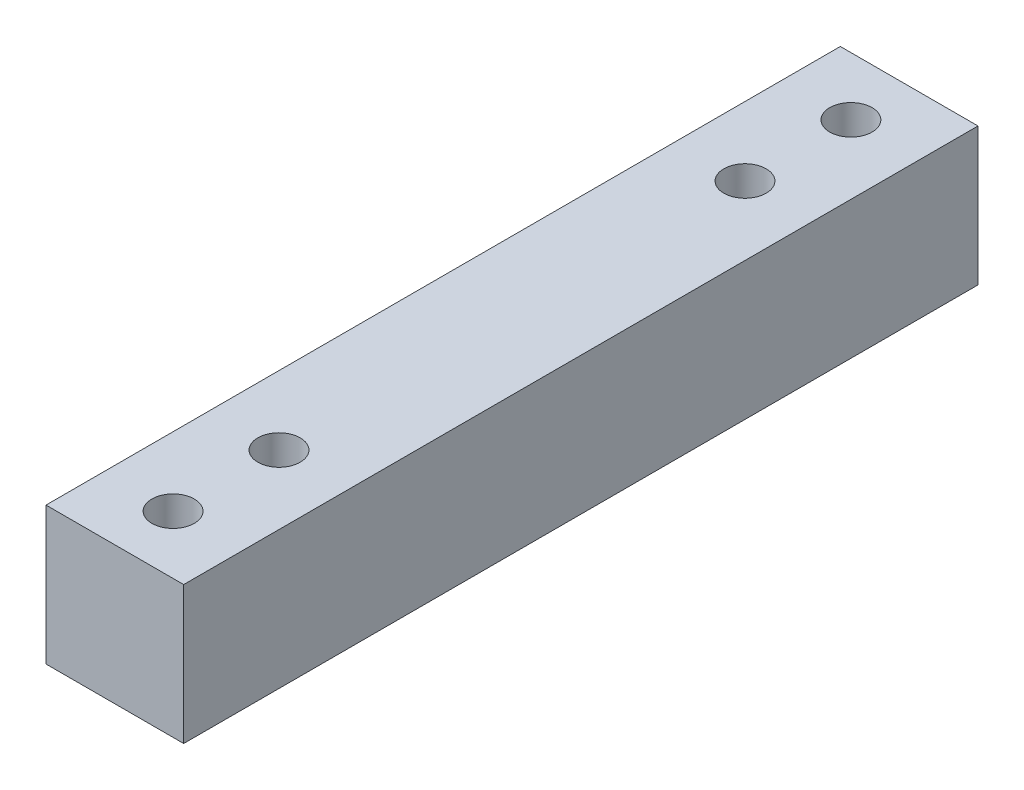
from build123d import *

# Parameters (mm, degrees)
SKETCH1_W           = 13
SKETCH1_H           = 13
BOSS_EXTRUDE1_DEPTH = 75
SKETCH2_R           = 2
CUT_EXTRUDE1_DEPTH  = 75


with BuildPart() as part:
    # Sketch1 → Boss-Extrude1 (new body)
    with BuildSketch(Plane.XY):
        Rectangle(SKETCH1_W, SKETCH1_H)
    extrude(amount=BOSS_EXTRUDE1_DEPTH)

    # Sketch2 → Cut-Extrude1 (cut)
    with BuildSketch(Plane(origin=(0, 6.5, 0), x_dir=(1, 0, 0), z_dir=(0, 1, 0))):
        with Locations(Location((0, -69.5, 0), (0, 0, 270))):
            Circle(SKETCH2_R)
        with Locations(Location((0, -59.5, 0), (0, 0, 270))):
            Circle(SKETCH2_R)
        with Locations(Location((0, -5.5, 0), (0, 0, 270))):
            Circle(SKETCH2_R)
        with Locations(Location((0, -15.5, 0), (0, 0, 270))):
            Circle(SKETCH2_R)
    extrude(amount=-CUT_EXTRUDE1_DEPTH, mode=Mode.SUBTRACT)


solid = part.part
